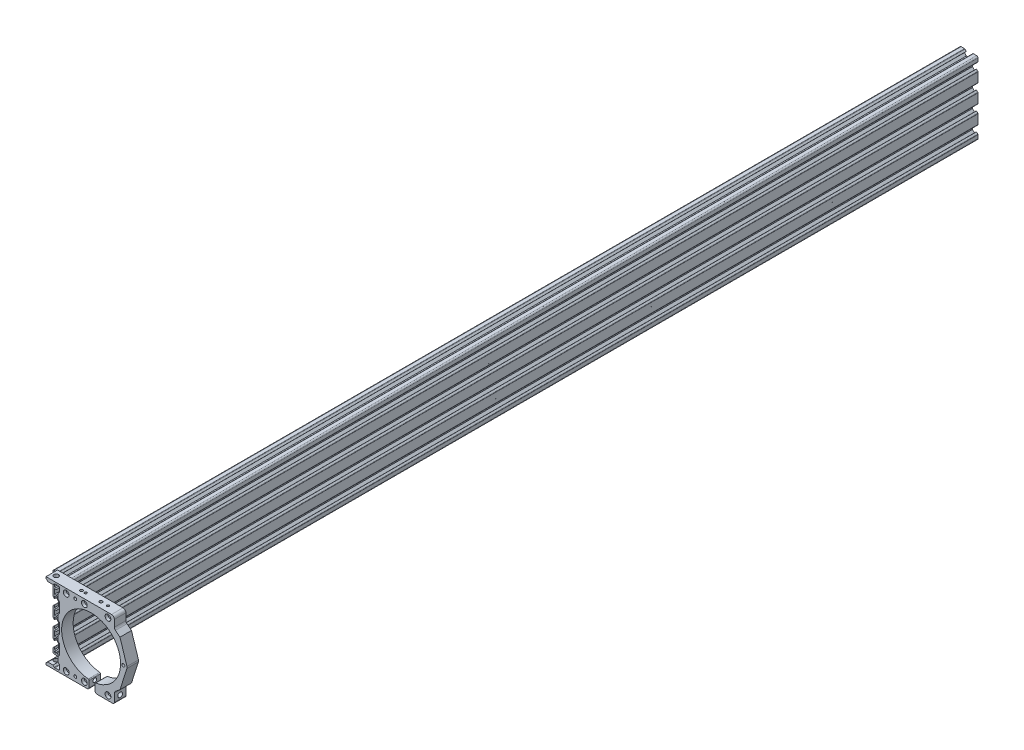
from build123d import *

# Parameters (mm, degrees)
SKETCH3_R           = 2.1
BOSS_EXTRUDE1_DEPTH = 1000
BOSS_EXTRUDE2_DEPTH = 12.7
SKETCH10_R          = 2.6
CUT_EXTRUDE1_DEPTH  = 21.324627
SKETCH11_R          = 1.25
SKETCH11_R_2        = 1.65
CUT_EXTRUDE2_DEPTH  = 10
CUT_EXTRUDE3_START  = -12.7
SKETCH12_R          = 3.175
SKETCH12_R_2        = 1.5875
CUT_EXTRUDE3_DEPTH  = 3.175
SKETCH13_R          = 2.525
CUT_EXTRUDE4_DEPTH  = 1008.08954349


with BuildPart() as part:
    # Sketch3 → Boss-Extrude1 (new body)
    with BuildSketch(Plane.XY):
        with BuildLine():
            Line((-0.1, 3.9), (0, 3.8))
            Line((0, 3.8), (0.1, 3.9))
            Line((0.1, 3.9), (2.840365134, 3.9))
            Line((2.840365134, 3.9), (5.5, 6.558825842))
            Line((5.5, 6.558825842), (5.5, 8.197505675))
            Line((5.5, 8.197505675), (2.89, 8.197505675))
            Line((2.89, 8.197505675), (2.89, 8.307505675))
            Line((2.89, 8.307505675), (4.348614357, 9.766120032))
            ThreePointArc((4.348614357, 9.766120032), (4.604908803, 9.937370505), (4.907228714, 9.997505675))
            Line((4.907228714, 9.997505675), (8.5, 9.997505675))
            ThreePointArc((8.5, 9.997505675), (9.560660172, 9.558165846), (10, 8.497505675))
            Line((10, 8.497505675), (10, 4.904734389))
            ThreePointArc((10, 4.904734389), (9.939864831, 4.602414477), (9.768614357, 4.346120032))
            Line((9.768614357, 4.346120032), (8.31, 2.887505675))
            Line((8.31, 2.887505675), (8.2, 2.887505675))
            Line((8.2, 2.887505675), (8.2, 5.497505675))
            Line((8.2, 5.497505675), (6.56, 5.497505675))
            Line((6.56, 5.497505675), (3.9, 2.83831481))
            Line((3.9, 2.83831481), (3.9, 0.1))
            Line((3.9, 0.1), (3.8, 0))
            Line((3.8, 0), (3.9, -0.1))
            Line((3.9, -0.1), (3.9, -2.84))
            Line((3.9, -2.84), (6.56, -5.5))
            Line((6.56, -5.5), (8.21, -5.5))
            Line((8.21, -5.5), (8.21, -2.89))
            Line((8.21, -2.89), (8.31, -2.89))
            Line((8.31, -2.89), (9.765685425, -4.345685425))
            ThreePointArc((9.765685425, -4.345685425), (9.939103626, -4.605224104), (10, -4.91137085))
            Line((10, -4.91137085), (10, -15.08862915))
            ThreePointArc((10, -15.08862915), (9.939103626, -15.394775896), (9.765685425, -15.654314575))
            Line((9.765685425, -15.654314575), (8.31, -17.11))
            Line((8.31, -17.11), (8.21, -17.11))
            Line((8.21, -17.11), (8.21, -14.5))
            Line((8.21, -14.5), (6.56, -14.5))
            Line((6.56, -14.5), (3.9, -17.16))
            Line((3.9, -17.16), (3.9, -19.9))
            Line((3.9, -19.9), (3.8, -20))
            Line((3.8, -20), (3.9, -20.1))
            Line((3.9, -20.1), (3.9, -22.838679656))
            Line((3.9, -22.838679656), (6.56, -25.498679656))
            Line((6.56, -25.498679656), (8.21, -25.498679656))
            Line((8.21, -25.498679656), (8.21, -22.888679656))
            Line((8.21, -22.888679656), (8.31, -22.888679656))
            Line((8.31, -22.888679656), (9.765685425, -24.344365081))
            ThreePointArc((9.765685425, -24.344365081), (9.939103626, -24.60390376), (10, -24.910050506))
            Line((10, -24.910050506), (10, -35.109949494))
            ThreePointArc((10, -35.109949494), (9.939103626, -35.41609624), (9.765685425, -35.675634919))
            Line((9.765685425, -35.675634919), (8.31, -37.131320344))
            Line((8.31, -37.131320344), (8.21, -37.131320344))
            Line((8.21, -37.131320344), (8.21, -34.521320344))
            Line((8.21, -34.521320344), (6.56, -34.521320344))
            Line((6.56, -34.521320344), (3.9, -37.181320344))
            Line((3.9, -37.181320344), (3.9, -39.92))
            Line((3.9, -39.92), (3.8, -40.02))
            Line((3.8, -40.02), (3.9, -40.12))
            Line((3.9, -40.12), (3.9, -42.86))
            Line((3.9, -42.86), (6.56, -45.52))
            Line((6.56, -45.52), (8.21, -45.52))
            Line((8.21, -45.52), (8.21, -42.91))
            Line((8.21, -42.91), (8.31, -42.91))
            Line((8.31, -42.91), (9.765685425, -44.365685425))
            ThreePointArc((9.765685425, -44.365685425), (9.939103626, -44.625224104), (10, -44.93137085))
            Line((10, -44.93137085), (10, -55.10862915))
            ThreePointArc((10, -55.10862915), (9.939103626, -55.414775896), (9.765685425, -55.674314575))
            Line((9.765685425, -55.674314575), (8.31, -57.13))
            Line((8.31, -57.13), (8.21, -57.13))
            Line((8.21, -57.13), (8.21, -54.52))
            Line((8.21, -54.52), (6.56, -54.52))
            Line((6.56, -54.52), (3.9, -57.18))
            Line((3.9, -57.18), (3.9, -59.92))
            Line((3.9, -59.92), (3.8, -60.02))
            Line((3.8, -60.02), (3.9, -60.12))
            Line((3.9, -60.12), (3.9, -62.85831481))
            Line((3.9, -62.85831481), (6.56, -65.517505675))
            Line((6.56, -65.517505675), (8.2, -65.517505675))
            Line((8.2, -65.517505675), (8.2, -62.907505675))
            Line((8.2, -62.907505675), (8.31, -62.907505675))
            Line((8.31, -62.907505675), (9.768614357, -64.366120032))
            ThreePointArc((9.768614357, -64.366120032), (9.939864831, -64.622414477), (10, -64.924734389))
            Line((10, -64.924734389), (10, -68.517505675))
            ThreePointArc((10, -68.517505675), (9.560660172, -69.578165846), (8.5, -70.017505675))
            Line((8.5, -70.017505675), (4.907228714, -70.017505675))
            ThreePointArc((4.907228714, -70.017505675), (4.604908803, -69.957370505), (4.348614357, -69.786120032))
            Line((4.348614357, -69.786120032), (2.89, -68.327505675))
            Line((2.89, -68.327505675), (2.89, -68.217505675))
            Line((2.89, -68.217505675), (5.5, -68.217505675))
            Line((5.5, -68.217505675), (5.5, -66.578825842))
            Line((5.5, -66.578825842), (2.840365134, -63.92))
            Line((2.840365134, -63.92), (0.1, -63.92))
            Line((0.1, -63.92), (0, -63.82))
            Line((0, -63.82), (-0.1, -63.92))
            Line((-0.1, -63.92), (-2.840365134, -63.92))
            Line((-2.840365134, -63.92), (-5.5, -66.578825842))
            Line((-5.5, -66.578825842), (-5.5, -68.217505675))
            Line((-5.5, -68.217505675), (-2.89, -68.217505675))
            Line((-2.89, -68.217505675), (-2.89, -68.327505675))
            Line((-2.89, -68.327505675), (-4.348614357, -69.786120032))
            ThreePointArc((-4.348614357, -69.786120032), (-4.604908803, -69.957370505), (-4.907228714, -70.017505675))
            Line((-4.907228714, -70.017505675), (-8.5, -70.017505675))
            ThreePointArc((-8.5, -70.017505675), (-9.560660172, -69.578165846), (-10, -68.517505675))
            Line((-10, -68.517505675), (-10, -64.924734389))
            ThreePointArc((-10, -64.924734389), (-9.939864831, -64.622414477), (-9.768614357, -64.366120032))
            Line((-9.768614357, -64.366120032), (-8.31, -62.907505675))
            Line((-8.31, -62.907505675), (-8.2, -62.907505675))
            Line((-8.2, -62.907505675), (-8.2, -65.517505675))
            Line((-8.2, -65.517505675), (-6.56, -65.517505675))
            Line((-6.56, -65.517505675), (-3.9, -62.85831481))
            Line((-3.9, -62.85831481), (-3.9, -60.12))
            Line((-3.9, -60.12), (-3.8, -60.02))
            Line((-3.8, -60.02), (-3.9, -59.92))
            Line((-3.9, -59.92), (-3.9, -57.18))
            Line((-3.9, -57.18), (-6.56, -54.52))
            Line((-6.56, -54.52), (-8.21, -54.52))
            Line((-8.21, -54.52), (-8.21, -57.13))
            Line((-8.21, -57.13), (-8.31, -57.13))
            Line((-8.31, -57.13), (-9.765685425, -55.674314575))
            ThreePointArc((-9.765685425, -55.674314575), (-9.939103626, -55.414775896), (-10, -55.10862915))
            Line((-10, -55.10862915), (-10, -44.93137085))
            ThreePointArc((-10, -44.93137085), (-9.939103626, -44.625224104), (-9.765685425, -44.365685425))
            Line((-9.765685425, -44.365685425), (-8.31, -42.91))
            Line((-8.31, -42.91), (-8.21, -42.91))
            Line((-8.21, -42.91), (-8.21, -45.52))
            Line((-8.21, -45.52), (-6.56, -45.52))
            Line((-6.56, -45.52), (-3.9, -42.86))
            Line((-3.9, -42.86), (-3.9, -40.12))
            Line((-3.9, -40.12), (-3.8, -40.02))
            Line((-3.8, -40.02), (-3.9, -39.92))
            Line((-3.9, -39.92), (-3.9, -37.181320344))
            Line((-3.9, -37.181320344), (-6.56, -34.521320344))
            Line((-6.56, -34.521320344), (-8.21, -34.521320344))
            Line((-8.21, -34.521320344), (-8.21, -37.131320344))
            Line((-8.21, -37.131320344), (-8.31, -37.131320344))
            Line((-8.31, -37.131320344), (-9.765685425, -35.675634919))
            ThreePointArc((-9.765685425, -35.675634919), (-9.939103626, -35.41609624), (-10, -35.109949494))
            Line((-10, -35.109949494), (-10, -24.910050506))
            ThreePointArc((-10, -24.910050506), (-9.939103626, -24.60390376), (-9.765685425, -24.344365081))
            Line((-9.765685425, -24.344365081), (-8.31, -22.888679656))
            Line((-8.31, -22.888679656), (-8.21, -22.888679656))
            Line((-8.21, -22.888679656), (-8.21, -25.498679656))
            Line((-8.21, -25.498679656), (-6.56, -25.498679656))
            Line((-6.56, -25.498679656), (-3.9, -22.838679656))
            Line((-3.9, -22.838679656), (-3.9, -20.1))
            Line((-3.9, -20.1), (-3.8, -20))
            Line((-3.8, -20), (-3.9, -19.9))
            Line((-3.9, -19.9), (-3.9, -17.16))
            Line((-3.9, -17.16), (-6.56, -14.5))
            Line((-6.56, -14.5), (-8.21, -14.5))
            Line((-8.21, -14.5), (-8.21, -17.11))
            Line((-8.21, -17.11), (-8.31, -17.11))
            Line((-8.31, -17.11), (-9.765685425, -15.654314575))
            ThreePointArc((-9.765685425, -15.654314575), (-9.939103626, -15.394775896), (-10, -15.08862915))
            Line((-10, -15.08862915), (-10, -4.91137085))
            ThreePointArc((-10, -4.91137085), (-9.939103626, -4.605224104), (-9.765685425, -4.345685425))
            Line((-9.765685425, -4.345685425), (-8.31, -2.89))
            Line((-8.31, -2.89), (-8.21, -2.89))
            Line((-8.21, -2.89), (-8.21, -5.5))
            Line((-8.21, -5.5), (-6.56, -5.5))
            Line((-6.56, -5.5), (-3.9, -2.84))
            Line((-3.9, -2.84), (-3.9, -0.1))
            Line((-3.9, -0.1), (-3.8, 0))
            Line((-3.8, 0), (-3.9, 0.1))
            Line((-3.9, 0.1), (-3.9, 2.83831481))
            Line((-3.9, 2.83831481), (-6.56, 5.497505675))
            Line((-6.56, 5.497505675), (-8.2, 5.497505675))
            Line((-8.2, 5.497505675), (-8.2, 2.887505675))
            Line((-8.2, 2.887505675), (-8.31, 2.887505675))
            Line((-8.31, 2.887505675), (-9.768614357, 4.346120032))
            ThreePointArc((-9.768614357, 4.346120032), (-9.939864831, 4.602414477), (-10, 4.904734389))
            Line((-10, 4.904734389), (-10, 8.497505675))
            ThreePointArc((-10, 8.497505675), (-9.560660172, 9.558165846), (-8.5, 9.997505675))
            Line((-8.5, 9.997505675), (-4.907228714, 9.997505675))
            ThreePointArc((-4.907228714, 9.997505675), (-4.604908803, 9.937370505), (-4.348614357, 9.766120032))
            Line((-4.348614357, 9.766120032), (-2.89, 8.307505675))
            Line((-2.89, 8.307505675), (-2.89, 8.197505675))
            Line((-2.89, 8.197505675), (-5.5, 8.197505675))
            Line((-5.5, 8.197505675), (-5.5, 6.558825842))
            Line((-5.5, 6.558825842), (-2.840365134, 3.9))
            Line((-2.840365134, 3.9), (-0.1, 3.9))
        make_face()
        Circle(SKETCH3_R, mode=Mode.SUBTRACT)
        with Locations((0, -20)):
            Circle(SKETCH3_R, mode=Mode.SUBTRACT)
        with Locations(Location((0, -40.02, 0), (0, 0, 180))):
            Circle(SKETCH3_R, mode=Mode.SUBTRACT)
        with Locations(Location((0, -60.02, 0), (0, 0, 180))):
            Circle(SKETCH3_R, mode=Mode.SUBTRACT)
        Polygon((-7.66, 6.567505675), (-6.57, 7.657505675), (-6.57, 8.197505675), (-8.2, 8.197505675), (-8.2, 6.567505675), align=None, mode=Mode.SUBTRACT)
        Polygon((2.840365134, -3.9), (-2.840365134, -3.9), (-6.25, -7.309634866), (-8.21, -7.309634866), (-8.21, -12.7), (-6.25, -12.7), (-2.85, -16.1), (-0.1, -16.1), (0, -16.2), (0.1, -16.1), (2.85, -16.1), (6.25, -12.7), (8.21, -12.7), (8.21, -7.309634866), (6.25, -7.309634866), align=None, mode=Mode.SUBTRACT)
        Polygon((-0.1, -23.9), (0, -23.8), (0.1, -23.9), (2.84, -23.9), (6.25, -27.31), (8.21, -27.31), (8.21, -32.71), (6.25, -32.71), (2.84, -36.12), (0.1, -36.12), (0, -36.22), (-0.1, -36.12), (-2.84, -36.12), (-6.25, -32.71), (-8.21, -32.71), (-8.21, -27.31), (-6.25, -27.31), (-2.84, -23.9), align=None, mode=Mode.SUBTRACT)
        Polygon((8.2, 6.567505675), (7.66, 6.567505675), (6.57, 7.657505675), (6.57, 8.197505675), (8.2, 8.197505675), align=None, mode=Mode.SUBTRACT)
        Polygon((7.66, -66.587505675), (6.57, -67.677505675), (6.57, -68.217505675), (8.2, -68.217505675), (8.2, -66.587505675), align=None, mode=Mode.SUBTRACT)
        Polygon((2.840365134, -56.12), (6.25, -52.710365134), (8.21, -52.710365134), (8.21, -47.32), (6.25, -47.32), (2.85, -43.92), (0.1, -43.92), (0, -43.82), (-0.1, -43.92), (-2.85, -43.92), (-6.25, -47.32), (-8.21, -47.32), (-8.21, -52.710365134), (-6.25, -52.710365134), (-2.840365134, -56.12), align=None, mode=Mode.SUBTRACT)
        Polygon((-8.2, -66.587505675), (-7.66, -66.587505675), (-6.57, -67.677505675), (-6.57, -68.217505675), (-8.2, -68.217505675), align=None, mode=Mode.SUBTRACT)
    extrude(amount=-BOSS_EXTRUDE1_DEPTH)


with BuildPart() as body_2:
    # Sketch7 → Boss-Extrude2 (new body)
    with BuildSketch(Plane.XY):
        with BuildLine():
            Line((67.363432758, 12.097505675), (10.1, 12.097505675))
            Line((10.1, 12.097505675), (-4.907228714, 12.097505675))
            Line((-4.907228714, 12.097505675), (-4.907228714, 10.097505675))
            ThreePointArc((-4.907228714, 10.097505675), (-4.566640459, 10.029758459), (-4.277903679, 9.83683071))
            Line((-4.277903679, 9.83683071), (-2.819289322, 8.378216353))
            Line((-2.819289322, 8.378216353), (2.819289322, 8.378216353))
            Line((2.819289322, 8.378216353), (4.277903679, 9.83683071))
            ThreePointArc((4.277903679, 9.83683071), (4.566640459, 10.029758459), (4.907228714, 10.097505675))
            Line((4.907228714, 10.097505675), (8.5, 10.097505675))
            ThreePointArc((8.5, 10.097505675), (9.63137085, 9.628876525), (10.1, 8.497505675))
            Line((10.1, 8.497505675), (10.1, 4.904734389))
            ThreePointArc((10.1, 4.904734389), (10.032252784, 4.564146134), (9.839325035, 4.275409354))
            Line((9.839325035, 4.275409354), (8.380710678, 2.816794997))
            Line((8.380710678, 2.816794997), (8.380710678, -2.819289322))
            Line((8.380710678, -2.819289322), (9.836396103, -4.274974747))
            ThreePointArc((9.836396103, -4.274974747), (10.031491579, -4.566955761), (10.1, -4.91137085))
            Line((10.1, -4.91137085), (10.1, -15.08862915))
            ThreePointArc((10.1, -15.08862915), (10.031491579, -15.433044239), (9.836396103, -15.725025253))
            Line((9.836396103, -15.725025253), (8.380710678, -17.180710678))
            Line((8.380710678, -17.180710678), (8.380710678, -22.817968978))
            Line((8.380710678, -22.817968978), (9.836396103, -24.273654403))
            ThreePointArc((9.836396103, -24.273654403), (10.031491579, -24.565635417), (10.1, -24.910050506))
            Line((10.1, -24.910050506), (10.1, -35.109949494))
            ThreePointArc((10.1, -35.109949494), (10.031491579, -35.454364583), (9.836396103, -35.746345597))
            Line((9.836396103, -35.746345597), (8.380710678, -37.202031022))
            Line((8.380710678, -37.202031022), (8.380710678, -42.839289322))
            Line((8.380710678, -42.839289322), (9.836396103, -44.294974747))
            ThreePointArc((9.836396103, -44.294974747), (10.031491579, -44.586955761), (10.1, -44.93137085))
            Line((10.1, -44.93137085), (10.1, -55.10862915))
            ThreePointArc((10.1, -55.10862915), (10.031491579, -55.453044239), (9.836396103, -55.745025253))
            Line((9.836396103, -55.745025253), (8.380710678, -57.200710678))
            Line((8.380710678, -57.200710678), (8.380710678, -62.836794997))
            Line((8.380710678, -62.836794997), (9.839325035, -64.295409354))
            ThreePointArc((9.839325035, -64.295409354), (10.032252784, -64.584146134), (10.1, -64.924734389))
            Line((10.1, -64.924734389), (10.1, -68.517505675))
            ThreePointArc((10.1, -68.517505675), (9.63137085, -69.648876525), (8.5, -70.117505675))
            Line((8.5, -70.117505675), (4.907228714, -70.117505675))
            ThreePointArc((4.907228714, -70.117505675), (4.566640459, -70.049758459), (4.277903679, -69.85683071))
            Line((4.277903679, -69.85683071), (2.819289322, -68.398216353))
            Line((2.819289322, -68.398216353), (-2.819289322, -68.398216353))
            Line((-2.819289322, -68.398216353), (-4.277903679, -69.85683071))
            ThreePointArc((-4.277903679, -69.85683071), (-4.566640459, -70.049758459), (-4.907228714, -70.117505675))
            Line((-4.907228714, -70.117505675), (-4.907228714, -72.117505675))
            Line((-4.907228714, -72.117505675), (10.1, -72.117505675))
            Line((10.1, -72.117505675), (40.563806069, -72.117505675))
            ThreePointArc((40.563806069, -72.117505675), (41.978019631, -71.531719237), (42.563806069, -70.117505675))
            Line((42.563806069, -70.117505675), (42.563806069, -63.353320903))
            ThreePointArc((42.563806069, -63.353320903), (42.304279838, -62.681235642), (41.660408873, -62.357997891))
            ThreePointArc((41.660408873, -62.357997891), (43.759331923, 2.473334342), (50.003692455, -62.090704245))
            ThreePointArc((50.003692455, -62.090704245), (49.402191464, -62.429772596), (49.163806069, -63.077802837))
            Line((49.163806069, -63.077802837), (49.163806069, -70.117505675))
            ThreePointArc((49.163806069, -70.117505675), (49.749592507, -71.531719237), (51.163806069, -72.117505675))
            Line((51.163806069, -72.117505675), (68.488432758, -72.117505675))
            ThreePointArc((68.488432758, -72.117505675), (69.902646321, -71.531719237), (70.488432758, -70.117505675))
            Line((70.488432758, -70.117505675), (70.488432758, -61.518781211))
            ThreePointArc((70.488432758, -61.518781211), (70.798811263, -60.161014353), (71.668292496, -59.07295735))
            Line((71.668292496, -59.07295735), (76.653047935, -55.10862915))
            Line((76.653047935, -55.10862915), (84.334826754, -30.957201685))
            ThreePointArc((84.334826754, -30.957201685), (84.481835154, -30.01), (84.334826754, -29.062798315))
            Line((84.334826754, -29.062798315), (76.653047935, -4.91137085))
            Line((76.653047935, -4.91137085), (71.668292496, -0.94704265))
            ThreePointArc((71.668292496, -0.94704265), (70.798811263, 0.141014353), (70.488432758, 1.498781211))
            Line((70.488432758, 1.498781211), (70.488432758, 8.972505675))
            ThreePointArc((70.488432758, 8.972505675), (69.57314145, 11.182214366), (67.363432758, 12.097505675))
        make_face()
    extrude(amount=BOSS_EXTRUDE2_DEPTH)

    # Sketch10 → Cut-Extrude1 (cut)
    with BuildSketch(Plane(origin=(70.488432758, 0, 0), x_dir=(0, 0, -1), z_dir=(1, 0, 0))):
        with Locations(Location((-6.35, -66.186234897, 0), (0, 0, 90))):
            Circle(SKETCH10_R)
    extrude(amount=-CUT_EXTRUDE1_DEPTH, mode=Mode.SUBTRACT)

    # Sketch11 → Cut-Extrude2 (cut)
    with BuildSketch(Plane(origin=(0, 12.097505675, 0), x_dir=(1, 0, 0), z_dir=(0, 1, 0))):
        with Locations(Location((32.499488831, -6.35, 0), (0, 0, 270))):
            Circle(SKETCH11_R)
        with Locations(Location((57.099488831, -6.35, 0), (0, 0, 270))):
            Circle(SKETCH11_R)
        with Locations(Location((27.942541023, -6.35, 0), (0, 0, 270))):
            Circle(SKETCH11_R_2)
        with Locations(Location((49.342541023, -6.35, 0), (0, 0, 270))):
            Circle(SKETCH11_R_2)
    extrude(amount=-CUT_EXTRUDE2_DEPTH, mode=Mode.SUBTRACT)

    # Sketch12 → Cut-Extrude3 (cut)
    with BuildSketch(Plane(origin=(0, 0, 0), x_dir=(-1, 0, 0), z_dir=(0, 0, -1)).offset(CUT_EXTRUDE3_START)):
        with Locations(Location((-63.401253375, -67.117505675, 0), (0, 0, 180))):
            Circle(SKETCH12_R)
        with Locations(Location((-17.401253375, -67.117505675, 0), (0, 0, 180))):
            Circle(SKETCH12_R)
        with Locations(Location((-37.401253375, -67.117505675, 0), (0, 0, 180))):
            Circle(SKETCH12_R)
        with Locations(Location((-63.401253375, 7.097505675, 0), (0, 0, 180))):
            Circle(SKETCH12_R)
        with Locations(Location((-37.401253375, 7.097505675, 0), (0, 0, 180))):
            Circle(SKETCH12_R)
        with Locations(Location((-17.401253375, 7.097505675, 0), (0, 0, 180))):
            Circle(SKETCH12_R)
        with Locations(Location((-27.401253375, -67.117505675, 0), (0, 0, 180))):
            Circle(SKETCH12_R_2)
        with Locations(Location((-27.401253375, 7.097505675, 0), (0, 0, 180))):
            Circle(SKETCH12_R_2)
        with Locations(Location((-80.401253375, -30.01, 0), (0, 0, 180))):
            Circle(SKETCH12_R_2)
    extrude(amount=CUT_EXTRUDE3_DEPTH, mode=Mode.SUBTRACT)

    # Sketch13 → Cut-Extrude4 (cut, through all)
    with BuildSketch(Plane(origin=(0, 12.097505675, 0), x_dir=(1, 0, 0), z_dir=(0, 1, 0))):
        with Locations(Location((0, -6.35, 0), (0, 0, 270))):
            Circle(SKETCH13_R)
    extrude(amount=-CUT_EXTRUDE4_DEPTH, mode=Mode.SUBTRACT)

    # Sketch15 → M5x0.8 Tapped Hole1 (revolve, cut)
    with BuildSketch(Plane(origin=(42.563806069, -66.186234897, 6.35), x_dir=(0, 0, -1), z_dir=(0, 1, 0))):
        Polygon((0, 0), (0, 15.2618073), (2.1, 14), (2.1, 0), align=None)
    revolve(axis=Axis((48.913806069, -66.186234897, 6.35), (-1, 0, 0)), mode=Mode.SUBTRACT)


solid = Compound([part.part, body_2.part])
